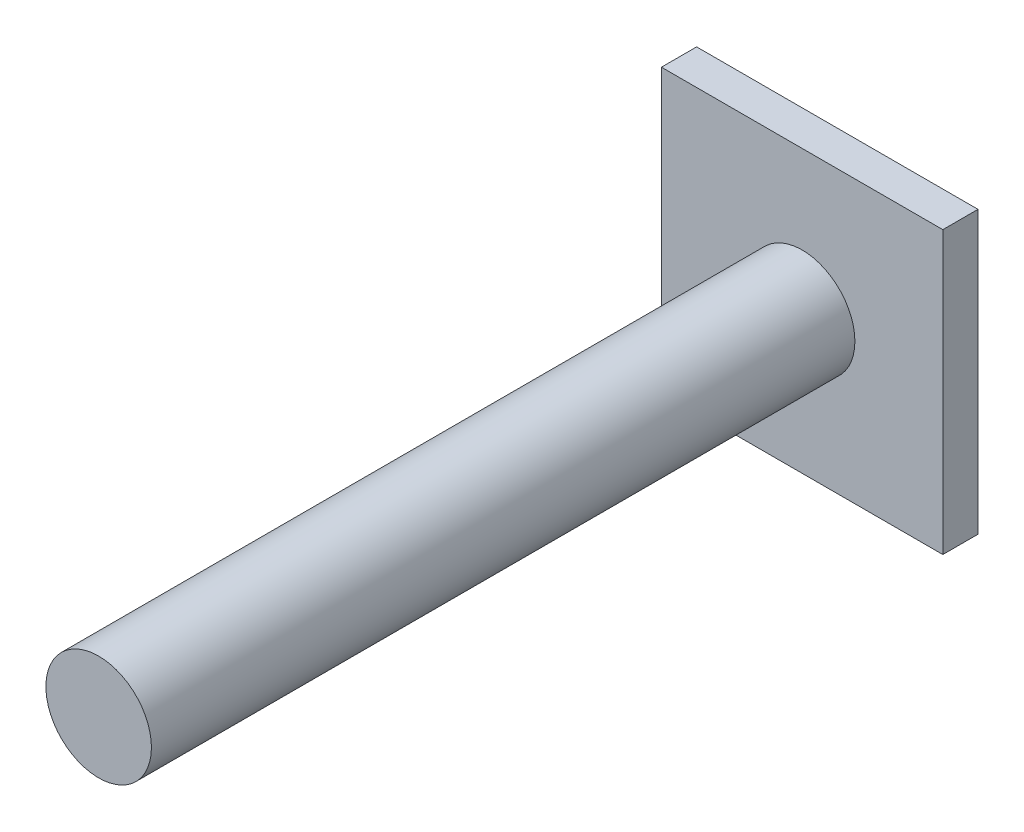
from build123d import *

# Parameters (mm, degrees)
ESBO_O1_W                = 40
ESBO_O1_H                = 40
RESSALTO_EXTRUS_O1_DEPTH = 5
ESBO_O2_R                = 7.5
RESSALTO_EXTRUS_O2_DEPTH = 100


with BuildPart() as part:
    # Esboço1 → Ressalto-extrusão1 (new body)
    with BuildSketch(Plane.XY):
        with Locations((20, 20)):
            Rectangle(ESBO_O1_W, ESBO_O1_H)
    extrude(amount=RESSALTO_EXTRUS_O1_DEPTH)

    # Esboço2 → Ressalto-extrusão2 (add)
    with BuildSketch(Plane.XY.offset(5)):
        with Locations((20, 20)):
            Circle(ESBO_O2_R)
    extrude(amount=RESSALTO_EXTRUS_O2_DEPTH)


solid = part.part
